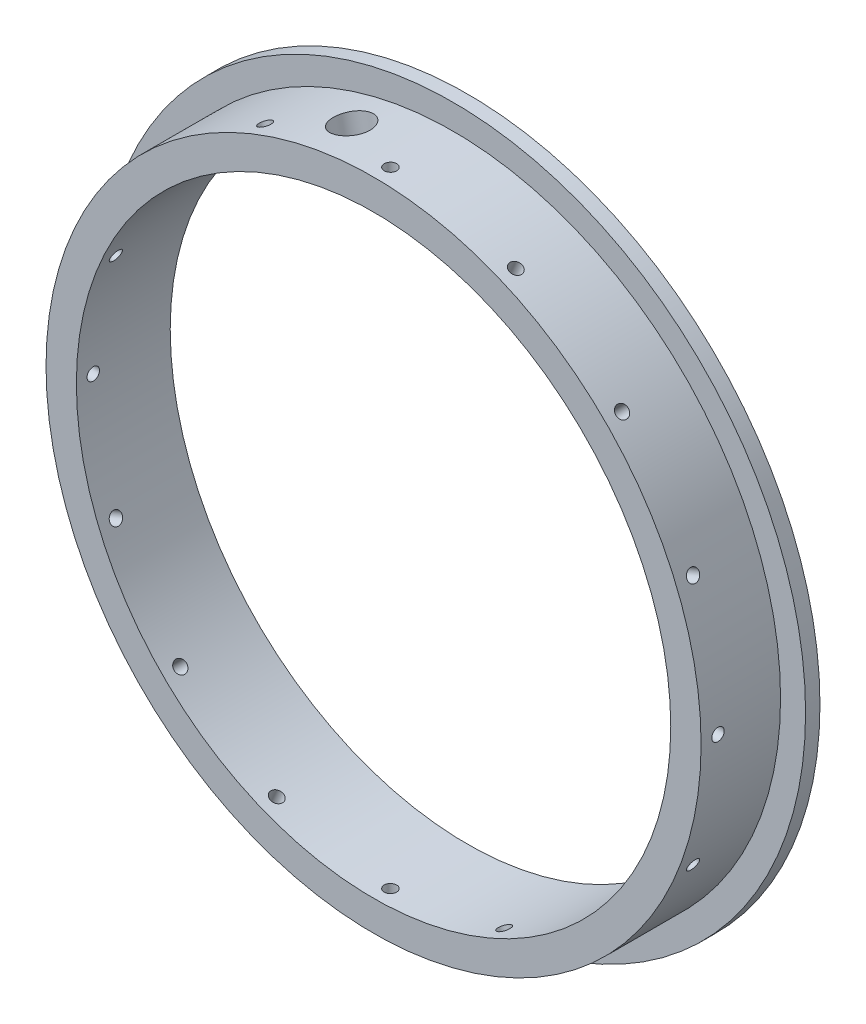
from build123d import *

# Parameters (mm, degrees)
SKETCH1_R         = 71.5645
EXTRUDE1_DEPTH    = 19.05
SKETCH2_R         = 60.325
EXTRUDE2_DEPTH    = 19.05
SKETCH3_OUTSIDE_W = 185.79
SKETCH3_OUTSIDE_H = 185.79
SKETCH3_OUTSIDE_R = 66.4845
EXTRUDE3_DEPTH    = 16.129
CIRPATTERN1_COUNT = 16
SKETCH102_R       = 3.81
EXTRUDE6_DEPTH    = 10.16


with BuildPart() as part:
    # Sketch1 → Extrude1 (new body)
    with BuildSketch(Plane.XY):
        with Locations(Location((0, 0, 0), (0, 0, 180))):
            Circle(SKETCH1_R)
    extrude(amount=EXTRUDE1_DEPTH)

    # Sketch2 → Extrude2 (cut)
    with BuildSketch(Plane.XY.offset(19.05)):
        Circle(SKETCH2_R)
    extrude(amount=-EXTRUDE2_DEPTH, mode=Mode.SUBTRACT)

    # Sketch3 outside → Extrude3 (cut)
    with BuildSketch(Plane.XY.offset(19.05)):
        Rectangle(SKETCH3_OUTSIDE_W, SKETCH3_OUTSIDE_H)
        Circle(SKETCH3_OUTSIDE_R, mode=Mode.SUBTRACT)
    extrude(amount=-EXTRUDE3_DEPTH, mode=Mode.SUBTRACT)

    # Sketch41 → #39 (0.0995) Diameter Hole5 (revolve, cut)
    with BuildSketch(Plane(origin=(61.423668779, 25.442516659, 15.621), x_dir=(-0.3826834323651011, 0.9238795325112822, 0), z_dir=(0, 0, 1))):
        Polygon((0, 0), (0, 13.459277521), (1.26365, 12.7), (1.26365, 0), align=None)
    f_39_0_0995_diameter_hole5 = revolve(axis=Axis((67.290303811, 27.872556455, 15.621), (-0.9238795325112822, -0.3826834323651011, 0)), mode=Mode.SUBTRACT)

    # CirPattern1: #39 (0.0995) Diameter Hole5 ×16 about axis
    cirpattern1_axis = Axis((0, 0, 0), (0, 0, 1))
    for i in range(1, CIRPATTERN1_COUNT):
        add(f_39_0_0995_diameter_hole5.rotate(cirpattern1_axis, i * 360 / CIRPATTERN1_COUNT), mode=Mode.SUBTRACT)

    # Sketch102 → Extrude6 (cut)
    with BuildSketch(Plane(origin=(-12.970482514, 65.207018975, 10.541), x_dir=(-0.9807852804032304, -0.19509032201612878, 0), z_dir=(-0.19509032201612878, 0.9807852804032304, 0))):
        Circle(SKETCH102_R)
    extrude(amount=-EXTRUDE6_DEPTH, mode=Mode.SUBTRACT)


solid = part.part
